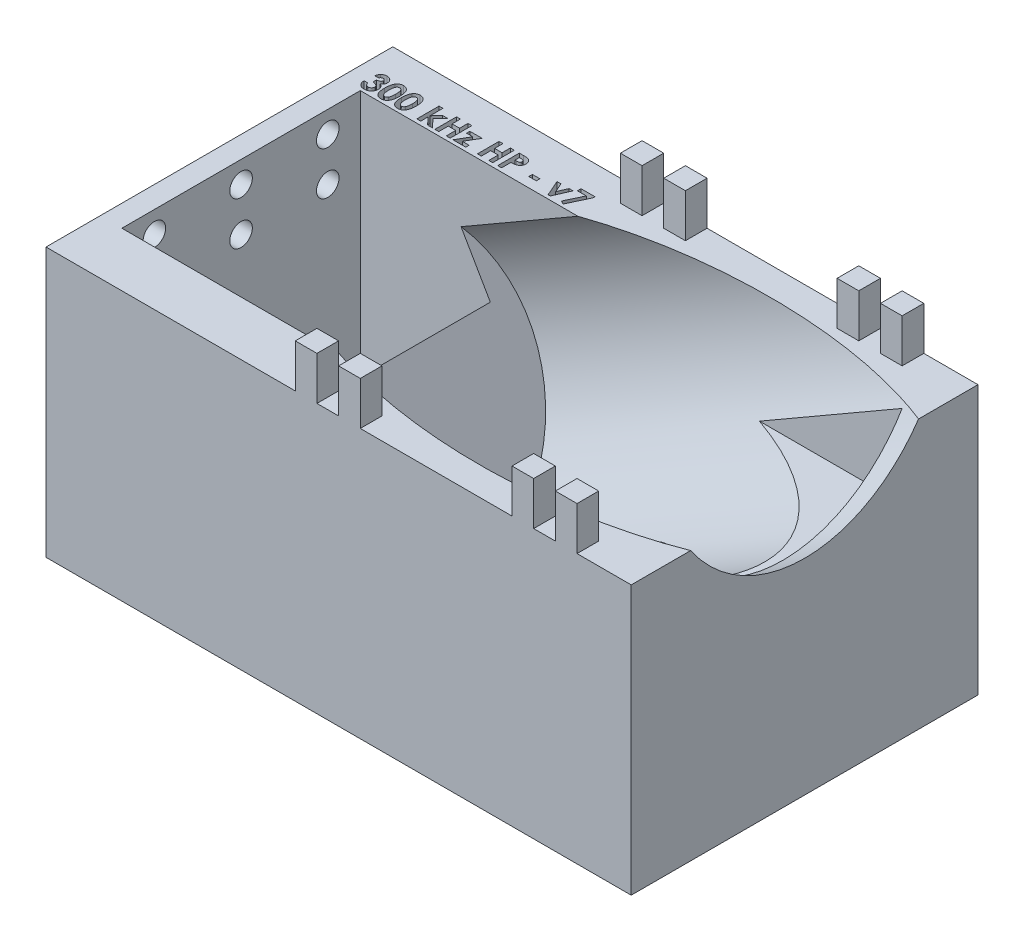
from build123d import *

# Parameters (mm, degrees)
SKETCH1_W                = 228.6
SKETCH1_H                = 127
BOSS_EXTRUDE1_DEPTH      = 50.8
SKETCH10_R               = 12.7
CUT_EXTRUDE6_DEPTH       = 196.514014843
SKETCH13_W               = 6.35
SKETCH13_H               = 6.35
BOSS_EXTRUDE3_DEPTH      = 12.7
SKETCH22_W               = 25.4
SKETCH22_H               = 101.6
CUT_EXTRUDE17_DEPTH      = 196.514014908
SKETCH23_W               = 254
SKETCH23_H               = 254
CUT_EXTRUDE18_DEPTH      = 48.26
SKETCH21_W               = 31.75
SKETCH21_H               = 101.6
CUT_EXTRUDE16_DEPTH      = 148.800939157
SKETCH26_W               = 88.9
SKETCH26_H               = 69.85
CUT_EXTRUDE21_DEPTH      = 25.4
CUT_EXTRUDE22_DEPTH      = 196.386105315
CUT_EXTRUDE22_DEPTH_BACK = 25.4
SKETCH27_R               = 3.302
SKETCH28_W               = 2.198076923
SKETCH28_H               = 1.058333333
CUT_EXTRUDE23_DEPTH      = 3.175
SKETCH30_R               = 3.429
CUT_EXTRUDE24_DEPTH      = 136.978989714
CUT_EXTRUDE25_DEPTH      = 136.978989714
CUT_EXTRUDE25_DEPTH_BACK = 46.99
SKETCH31_W               = 38.1
SKETCH31_H               = 69.85
CUT_EXTRUDE26_START      = -14.812699
SKETCH32_W               = 34.776392942
SKETCH32_H               = 69.85
CUT_EXTRUDE26_DEPTH      = 14.812699


with BuildPart() as part:
    # Sketch1 → Boss-Extrude1 (new, symmetric)
    with BuildSketch(Plane.XY):
        with Locations((-25.4, -63.5)):
            Rectangle(SKETCH1_W, SKETCH1_H)
    extrude(amount=BOSS_EXTRUDE1_DEPTH, both=True)

    # Sketch10 → Cut-Extrude6 (cut, through all)
    with BuildSketch(Plane.XZ.offset(127)):
        with Locations(Location((0, 0, 0), (0, 0, 270))):
            Circle(SKETCH10_R)
    extrude(amount=-CUT_EXTRUDE6_DEPTH, mode=Mode.SUBTRACT)

    # Sketch2 → Cut-Revolve1 (revolve, cut)
    with BuildSketch(Plane.XY, mode=Mode.PRIVATE) as cut_revolve1_sk:
        Polygon((0, 46.586734405), (-66.080481187, 8.435150804), (-87.55791114, -3.964849161), (-68.30288881, -37.315526138), (-66.28541114, -40.809899965), (0, -2.54), (87.988181024, 48.26), (66.715681024, 85.105050804), align=None)
    revolve(cut_revolve1_sk.sketch.rotate(Axis((-66.28541114, -40.809899965, 0), (0.8660254037844379, 0.5000000000000012, 0)), 180), axis=Axis((-66.28541114, -40.809899965, 0), (0.8660254037844379, 0.5000000000000012, 0)), mode=Mode.SUBTRACT)

    # Sketch13 → Boss-Extrude3 (add)
    with BuildSketch(Plane(origin=(0, 0, 0), x_dir=(1, 0, 0), z_dir=(0, 1, 0))):
        with Locations((-38.1, 47.625)):
            Rectangle(SKETCH13_W, SKETCH13_H)
        with Locations((-25.4, 47.625)):
            Rectangle(SKETCH13_W, SKETCH13_H)
        with Locations((25.4, 47.625)):
            Rectangle(SKETCH13_W, SKETCH13_H)
        with Locations((38.1, 47.625)):
            Rectangle(SKETCH13_W, SKETCH13_H)
        with Locations((38.1, -47.625)):
            Rectangle(SKETCH13_W, SKETCH13_H)
        with Locations((25.4, -47.625)):
            Rectangle(SKETCH13_W, SKETCH13_H)
        with Locations((-25.4, -47.625)):
            Rectangle(SKETCH13_W, SKETCH13_H)
        with Locations((-38.1, -47.625)):
            Rectangle(SKETCH13_W, SKETCH13_H)
    extrude(amount=BOSS_EXTRUDE3_DEPTH)

    # Sketch22 → Cut-Extrude17 (cut, through all)
    with BuildSketch(Plane(origin=(0, 0, 0), x_dir=(1, 0, 0), z_dir=(0, 1, 0))):
        with Locations((-127, 0)):
            Rectangle(SKETCH22_W, SKETCH22_H)
    extrude(amount=-CUT_EXTRUDE17_DEPTH, mode=Mode.SUBTRACT)

    # Sketch23 → Cut-Extrude18 (cut)
    with BuildSketch(Plane.XZ.offset(127)):
        Rectangle(SKETCH23_W, SKETCH23_H)
    extrude(amount=-CUT_EXTRUDE18_DEPTH, mode=Mode.SUBTRACT)

    # Sketch21 → Cut-Extrude16 (cut, through all)
    with BuildSketch(Plane(origin=(0, 0, 0), x_dir=(1, 0, 0), z_dir=(0, 1, 0))):
        with Locations((73.025, 0)):
            Rectangle(SKETCH21_W, SKETCH21_H)
    extrude(amount=-CUT_EXTRUDE16_DEPTH, mode=Mode.SUBTRACT)

    # Sketch26 → Cut-Extrude21 (cut)
    with BuildSketch(Plane(origin=(0, 0, 0), x_dir=(1, 0, 0), z_dir=(0, 1, 0))):
        with Locations((6.35, 0)):
            Rectangle(SKETCH26_W, SKETCH26_H)
    extrude(amount=-CUT_EXTRUDE21_DEPTH, mode=Mode.SUBTRACT)

    # Sketch27 → Cut-Extrude22 (cut, two sides: drawn at the far end of the back side and taken through both)
    with BuildSketch(Plane.ZY.offset(114.3).offset(-CUT_EXTRUDE22_DEPTH_BACK)):
        with Locations(Location((-25.4, -6.35, 0), (0, 0, 180))):
            Circle(SKETCH27_R)
        with Locations(Location((0, -6.35, 0), (0, 0, 180))):
            Circle(SKETCH27_R)
        with Locations(Location((0, -19.05, 0), (0, 0, 180))):
            Circle(SKETCH27_R)
        with Locations(Location((25.4, -6.35, 0), (0, 0, 180))):
            Circle(SKETCH27_R)
        with Locations(Location((25.4, -19.05, 0), (0, 0, 180))):
            Circle(SKETCH27_R)
        with Locations(Location((-25.4, -19.05, 0), (0, 0, 180))):
            Circle(SKETCH27_R)
    extrude(amount=CUT_EXTRUDE22_DEPTH + CUT_EXTRUDE22_DEPTH_BACK, mode=Mode.SUBTRACT)

    # Sketch28 → Cut-Extrude23 (cut)
    # profile 1 of 11: a face of its own
    with BuildSketch(Plane(origin=(0, 0, 0), x_dir=(1, 0, 0), z_dir=(0, 1, 0))):
        with BuildLine():
            Line((-108.439595668, 40.823041991), (-109.579339258, 40.823041991))
            add(Edge.make_bspline(
                [(-109.579339258, 40.823041991), (-109.571292235, 40.880013707), (-109.555516579, 40.991702982), (-109.517767544, 41.15340123), (-109.472615625, 41.306783084), (-109.41624576, 41.451362816), (-109.35013308, 41.587397969), (-109.274949876, 41.71535535), (-109.18988339, 41.834685743), (-109.124679027, 41.906570845), (-109.092149755, 41.942433016)],
                knots=[0, 0, 0, 0, 1.111473889, 2.178970933, 3.205615836, 4.199322666, 5.174200091, 6.12565194, 7.064921805, 8, 8, 8, 8], degree=3))
            add(Edge.make_bspline(
                [(-109.092149755, 41.942433016), (-109.04523059, 41.989750553), (-108.952757848, 42.083008445), (-108.798225049, 42.202461503), (-108.636246138, 42.305840002), (-108.463572556, 42.387799223), (-108.282891233, 42.454135718), (-108.092765331, 42.498694091), (-107.893971771, 42.528258965), (-107.758320175, 42.531171208), (-107.689094867, 42.532657375)],
                knots=[0, 0, 0, 0, 1.01925491, 2.00884431, 2.983262333, 3.955970413, 4.92937149, 5.924503185, 6.940838805, 8, 8, 8, 8], degree=3))
            add(Edge.make_bspline(
                [(-107.689094867, 42.532657375), (-107.627550006, 42.531204422), (-107.506565211, 42.528348208), (-107.328748005, 42.505420072), (-107.15921418, 42.465206676), (-106.996171714, 42.412628563), (-106.84201843, 42.341087252), (-106.693352017, 42.258043018), (-106.554326218, 42.156185813), (-106.42461574, 42.041097423), (-106.305451927, 41.916618062), (-106.202255542, 41.783559862), (-106.113535759, 41.645477115), (-106.040442393, 41.501222613), (-105.984243527, 41.350552262), (-105.945239847, 41.194336462), (-105.919710992, 41.032919917), (-105.917167651, 40.923207266), (-105.915877719, 40.867563225)],
                knots=[0, 0, 0, 0, 1.091422571, 2.145516843, 3.172569842, 4.178562979, 5.178154469, 6.181868002, 7.194278174, 8.227918432, 9.254613415, 10.245994977, 11.209837596, 12.161663635, 13.10878368, 14.055455738, 15.013766427, 16, 16, 16, 16], degree=3))
            add(Edge.make_bspline(
                [(-105.915877719, 40.867563225), (-105.918524735, 40.798652714), (-105.923735896, 40.662989104), (-105.966497241, 40.464435331), (-106.033430374, 40.274582491), (-106.130121795, 40.09608691), (-106.251010699, 39.929434354), (-106.399337334, 39.780196517), (-106.570876975, 39.646033552), (-106.699654067, 39.573934358), (-106.765597271, 39.537014347)],
                knots=[0, 0, 0, 0, 0.992805628, 1.954529043, 2.915727527, 3.886831945, 4.871318353, 5.87440735, 6.911542536, 8, 8, 8, 8], degree=3))
            add(Edge.make_bspline(
                [(-106.765597271, 39.537014347), (-106.720334868, 39.522153747), (-106.631396276, 39.492953334), (-106.504980761, 39.435443453), (-106.384774052, 39.372594684), (-106.272846064, 39.299580983), (-106.16808354, 39.2193547), (-106.071125122, 39.13123003), (-105.981391508, 39.035399128), (-105.900347562, 38.931334959), (-105.828417893, 38.820701827), (-105.763879232, 38.706055293), (-105.710760316, 38.58565672), (-105.665761981, 38.460881142), (-105.631502811, 38.330607142), (-105.607381294, 38.195339519), (-105.593438465, 38.05538683), (-105.591311945, 37.960568968), (-105.590236694, 37.912625324)],
                knots=[0, 0, 0, 0, 1.059543567, 2.081955587, 3.086750234, 4.076226789, 5.052108497, 6.020845489, 6.989030705, 7.970690546, 8.952259656, 9.923888338, 10.895517021, 11.877585046, 12.873342345, 13.889638361, 14.932918083, 16, 16, 16, 16], degree=3))
            add(Edge.make_bspline(
                [(-105.590236694, 37.912625324), (-105.592416374, 37.842167634), (-105.596714258, 37.703239418), (-105.624038199, 37.498612373), (-105.674910453, 37.303518667), (-105.741835722, 37.11571345), (-105.831106766, 36.937621221), (-105.936163778, 36.765155005), (-106.065299953, 36.604295884), (-106.208812638, 36.450791159), (-106.368191842, 36.311231537), (-106.540984827, 36.190239624), (-106.723392024, 36.086407035), (-106.916567472, 36.002112782), (-107.120444057, 35.937196566), (-107.334567356, 35.890272133), (-107.559837056, 35.861562988), (-107.713601251, 35.858553379), (-107.792129723, 35.85701635)],
                knots=[0, 0, 0, 0, 1.005138573, 1.981928558, 2.936866704, 3.876260664, 4.820238198, 5.773547, 6.751179199, 7.756627054, 8.768222608, 9.766606018, 10.760583154, 11.757261445, 12.767156078, 13.807575856, 14.880313354, 16, 16, 16, 16], degree=3))
            add(Edge.make_bspline(
                [(-107.792129723, 35.85701635), (-107.86641639, 35.858636887), (-108.011674137, 35.861805633), (-108.224143994, 35.889232737), (-108.426076481, 35.933474881), (-108.617986934, 35.995837851), (-108.799132866, 36.076711966), (-108.971156979, 36.173014891), (-109.13062657, 36.290301154), (-109.279318443, 36.423276232), (-109.413934166, 36.57246672), (-109.53424892, 36.734416693), (-109.637609746, 36.909741981), (-109.724440526, 37.097693522), (-109.79406244, 37.298601039), (-109.848980002, 37.512055976), (-109.887340818, 37.738475358), (-109.899023685, 37.894256709), (-109.904980283, 37.973683016)],
                knots=[0, 0, 0, 0, 1.066544725, 2.085487077, 3.070979577, 4.031932826, 4.977951092, 5.916076795, 6.857635327, 7.814973522, 8.776389752, 9.738577119, 10.707772778, 11.69409279, 12.707140348, 13.757286496, 14.856535458, 16, 16, 16, 16], degree=3))
            Line((-109.904980283, 37.973683016), (-108.765236694, 37.973683016))
            add(Edge.make_bspline(
                [(-108.765236694, 37.973683016), (-108.758014257, 37.933746426), (-108.743946669, 37.855959444), (-108.7165087, 37.743341187), (-108.680753198, 37.639387579), (-108.639410942, 37.543174684), (-108.594755082, 37.453439261), (-108.540800124, 37.373495461), (-108.481499604, 37.301172481), (-108.395928521, 37.215194125), (-108.273598765, 37.126854954), (-108.108413067, 37.050084011), (-107.92465962, 37.005086807), (-107.796197635, 36.999597286), (-107.729799995, 36.996759939)],
                knots=[0, 0, 0, 0, 0.928156231, 1.807827665, 2.648129825, 3.438902246, 4.202261636, 4.936546065, 5.639352463, 6.338805438, 7.70633318, 9.064371875, 10.482673459, 12, 12, 12, 12], degree=3))
            add(Edge.make_bspline(
                [(-107.729799995, 36.996759939), (-107.69456706, 36.997364126), (-107.625553623, 36.998547592), (-107.524183161, 37.011664725), (-107.427613522, 37.033268655), (-107.335664841, 37.062627594), (-107.247751768, 37.09943086), (-107.165553968, 37.146886469), (-107.087396046, 37.202060389), (-107.01412765, 37.264090522), (-106.946426141, 37.331681163), (-106.890094505, 37.406526313), (-106.838611465, 37.482582364), (-106.800534238, 37.564825169), (-106.767170384, 37.648829187), (-106.746750001, 37.7376435), (-106.731331146, 37.829405024), (-106.730435064, 37.892202582), (-106.729980283, 37.924073641)],
                knots=[0, 0, 0, 0, 1.110435564, 2.175094844, 3.216326037, 4.226890168, 5.215276772, 6.21526065, 7.213097102, 8.228249917, 9.239874822, 10.221364777, 11.178138315, 12.128914389, 13.072518965, 14.022636769, 14.996447288, 16, 16, 16, 16], degree=3))
            add(Edge.make_bspline(
                [(-106.729980283, 37.924073641), (-106.73118764, 37.958930074), (-106.733591209, 38.028321246), (-106.753228623, 38.129583069), (-106.784240251, 38.226988782), (-106.827319189, 38.320107026), (-106.88484631, 38.408594586), (-106.952727671, 38.49422679), (-107.036311201, 38.572546634), (-107.128013528, 38.649963427), (-107.234352201, 38.717447522), (-107.350148378, 38.779725426), (-107.478445363, 38.829279411), (-107.616111312, 38.873540297), (-107.765750304, 38.905867762), (-107.926433137, 38.929340651), (-108.097900607, 38.94681258), (-108.216095362, 38.949319216), (-108.276775155, 38.950606093)],
                knots=[0, 0, 0, 0, 0.809814727, 1.612155564, 2.388397, 3.182215007, 3.988903953, 4.837162975, 5.715530372, 6.646997145, 7.623086902, 8.637258368, 9.698941581, 10.815059213, 11.996518529, 13.252603015, 14.589518788, 16, 16, 16, 16], degree=3))
            Line((-108.276775155, 38.950606093), (-108.276775155, 40.008939427))
            add(Edge.make_bspline(
                [(-108.276775155, 40.008939427), (-108.201225204, 40.015373502), (-108.059886206, 40.027410384), (-107.863700099, 40.055559049), (-107.698536686, 40.093184375), (-107.560426262, 40.138577293), (-107.445748216, 40.196873627), (-107.345566107, 40.261230206), (-107.259284537, 40.335970966), (-107.186365035, 40.418867149), (-107.128031703, 40.507889877), (-107.086746769, 40.601655471), (-107.059484355, 40.69726271), (-107.056901244, 40.762655179), (-107.055621309, 40.795057215)],
                knots=[0, 0, 0, 0, 1.70044513, 3.18119609, 4.440695891, 5.496282586, 6.431922213, 7.318171381, 8.16090191, 8.983045123, 9.787564368, 10.536848927, 11.275007137, 12, 12, 12, 12], degree=3))
            add(Edge.make_bspline(
                [(-107.055621309, 40.795057215), (-107.057829562, 40.836398695), (-107.062139605, 40.917088511), (-107.095613734, 41.032572635), (-107.153721029, 41.135517161), (-107.231632708, 41.225705463), (-107.326570798, 41.301037492), (-107.437854882, 41.355727261), (-107.56307009, 41.387859942), (-107.651165735, 41.391191018), (-107.696727078, 41.392913786)],
                knots=[0, 0, 0, 0, 1.009664648, 1.970651636, 2.907870547, 3.878035693, 4.867062054, 5.849714035, 6.887914197, 8, 8, 8, 8], degree=3))
            add(Edge.make_bspline(
                [(-107.696727078, 41.392913786), (-107.738023313, 41.390881101), (-107.819967691, 41.386847633), (-107.939794899, 41.356742892), (-108.053590825, 41.306065308), (-108.158999075, 41.236183907), (-108.254498061, 41.152259306), (-108.332875175, 41.052868036), (-108.398065543, 40.9439648), (-108.425698023, 40.863507611), (-108.439595668, 40.823041991)],
                knots=[0, 0, 0, 0, 0.98818071, 1.960853194, 2.938124878, 3.957524365, 4.978590984, 5.968022688, 6.978025184, 8, 8, 8, 8], degree=3))
        make_face()
    # profile 2 of 11: a face of its own
    with BuildSketch(Plane(origin=(0, 0, 0), x_dir=(1, 0, 0), z_dir=(0, 1, 0))):
        with BuildLine():
            add(Edge.make_bspline(
                [(-102.882073633, 42.532657375), (-102.826905313, 42.531838386), (-102.718429655, 42.530228034), (-102.55866543, 42.512786614), (-102.40476831, 42.486437491), (-102.25613623, 42.449689654), (-102.113839057, 42.401055199), (-101.976841125, 42.342840591), (-101.846773105, 42.271992353), (-101.721976214, 42.19196563), (-101.602498525, 42.101364034), (-101.491211599, 41.998073537), (-101.386083101, 41.884470857), (-101.289388676, 41.758838526), (-101.198986996, 41.622319302), (-101.115175106, 41.474891538), (-101.038594608, 41.315833674), (-100.968387215, 41.144858678), (-100.905607543, 40.959403708), (-100.852728303, 40.757341515), (-100.807375507, 40.538625954), (-100.769094546, 40.302712611), (-100.740160327, 40.049287898), (-100.720658081, 39.77852018), (-100.707274717, 39.490931456), (-100.70618246, 39.293647954), (-100.705621309, 39.192292792)],
                knots=[0, 0, 0, 0, 0.879237366, 1.728815576, 2.559023295, 3.367336655, 4.166867292, 4.954216142, 5.737608147, 6.525189134, 7.316157332, 8.124696809, 8.942788509, 9.781158001, 10.649253743, 11.551476218, 12.482711956, 13.461909668, 14.496590415, 15.601789533, 16.789733467, 18.056700938, 19.410929216, 20.8549011, 22.384193279, 24, 24, 24, 24], degree=3))
            add(Edge.make_bspline(
                [(-100.705621309, 39.192292792), (-100.706227762, 39.089669563), (-100.707406089, 38.89027447), (-100.720101731, 38.600055314), (-100.741964227, 38.327321659), (-100.770142189, 38.072101723), (-100.80873829, 37.834530282), (-100.853939689, 37.613992186), (-100.907653612, 37.410567376), (-100.972501226, 37.22471421), (-101.042283652, 37.053438944), (-101.119073631, 36.894691206), (-101.201532725, 36.748041017), (-101.287769572, 36.611275962), (-101.382511992, 36.488427804), (-101.481148604, 36.375319063), (-101.587974223, 36.276258196), (-101.698491078, 36.186140052), (-101.816747847, 36.10825989), (-101.94152498, 36.040147184), (-102.075047036, 35.984899691), (-102.214880136, 35.936848371), (-102.363407762, 35.902352709), (-102.518269832, 35.874981534), (-102.681214706, 35.859854544), (-102.79215414, 35.857977941), (-102.849000716, 35.85701635)],
                knots=[0, 0, 0, 0, 1.643780988, 3.193836972, 4.651895693, 6.025988579, 7.305620092, 8.505800249, 9.631074763, 10.672816429, 11.65661981, 12.592235626, 13.49536222, 14.350718032, 15.179365177, 15.97804903, 16.751647189, 17.51006938, 18.259804725, 19.016521909, 19.783502495, 20.571750527, 21.382245291, 22.22305063, 23.089471752, 24, 24, 24, 24], degree=3))
            add(Edge.make_bspline(
                [(-102.849000716, 35.85701635), (-102.905845758, 35.85799649), (-103.01720436, 35.85991657), (-103.180589853, 35.874869058), (-103.336272614, 35.90246359), (-103.485975333, 35.937113203), (-103.628656102, 35.984793372), (-103.764999071, 36.041693832), (-103.893955882, 36.109381548), (-104.015883594, 36.187443163), (-104.130365913, 36.276958349), (-104.239181892, 36.37696964), (-104.342090825, 36.487223534), (-104.437527211, 36.608954965), (-104.527054023, 36.740539073), (-104.609737636, 36.883478484), (-104.685528362, 37.037565081), (-104.756796946, 37.203013646), (-104.818720325, 37.383386097), (-104.873829257, 37.580293136), (-104.918973045, 37.795376147), (-104.955280699, 38.028566031), (-104.98426871, 38.279368765), (-105.005832458, 38.547905405), (-105.018598619, 38.834301029), (-105.019764588, 39.031155007), (-105.020364899, 39.132507135)],
                knots=[0, 0, 0, 0, 0.917216111, 1.796812873, 2.643793957, 3.46689424, 4.273913431, 5.068098542, 5.848489301, 6.620921603, 7.401012384, 8.190319798, 9.003608147, 9.831726257, 10.68377682, 11.569763213, 12.493818149, 13.453288342, 14.474581811, 15.568529029, 16.750744269, 18.018426408, 19.375425659, 20.823733699, 22.36466933, 24, 24, 24, 24], degree=3))
            add(Edge.make_bspline(
                [(-105.020364899, 39.132507135), (-105.019277492, 39.273327938), (-105.017179328, 39.545043491), (-104.990589845, 39.937593463), (-104.951563229, 40.300437914), (-104.894242373, 40.632969892), (-104.823365929, 40.936421), (-104.732604951, 41.208792261), (-104.62928018, 41.453852541), (-104.5412342, 41.599027727), (-104.498830444, 41.668945436)],
                knots=[0, 0, 0, 0, 1.288568992, 2.486310467, 3.599230591, 4.627010532, 5.572937695, 6.447898582, 7.252493626, 8, 8, 8, 8], degree=3))
            add(Edge.make_bspline(
                [(-104.498830444, 41.668945436), (-104.449525375, 41.737632572), (-104.353124251, 41.871929459), (-104.184564191, 42.048236167), (-104.003468352, 42.199022297), (-103.80611713, 42.320875424), (-103.595631717, 42.416968809), (-103.370204987, 42.484838486), (-103.130669404, 42.524382521), (-102.966176324, 42.529857901), (-102.882073633, 42.532657375)],
                knots=[0, 0, 0, 0, 1.058512271, 2.069600068, 3.047294572, 4.004278952, 4.967380941, 5.939006123, 6.946246673, 8, 8, 8, 8], degree=3))
        make_face()
        with BuildLine():
            add(Edge.make_bspline(
                [(-102.854088857, 41.392913786), (-102.903961476, 41.390549923), (-103.001738283, 41.385915496), (-103.143617089, 41.346575756), (-103.277399945, 41.285813406), (-103.37916499, 41.212695417), (-103.455335114, 41.142603057), (-103.508555726, 41.07917175), (-103.559878618, 41.008386984), (-103.60520958, 40.927054605), (-103.648013842, 40.838096982), (-103.689846508, 40.7411103), (-103.72413831, 40.633712357), (-103.757829096, 40.517732154), (-103.787345368, 40.389963146), (-103.812073533, 40.249360963), (-103.834165975, 40.095011255), (-103.849575717, 39.926812923), (-103.86394222, 39.744941945), (-103.874240811, 39.548993182), (-103.878546393, 39.339019497), (-103.879915006, 39.194413736), (-103.880621309, 39.119786782)],
                knots=[0, 0, 0, 0, 1.076674018, 2.110852608, 3.161083442, 4.239746716, 4.804137807, 5.395870207, 6.026861976, 6.692161227, 7.405688833, 8.16177676, 8.973626916, 9.841385931, 10.773283133, 11.807421078, 12.927755683, 14.143907515, 15.458935494, 16.872852025, 18.386167141, 20, 20, 20, 20], degree=3))
            add(Edge.make_bspline(
                [(-103.880621309, 39.119786782), (-103.87945882, 39.023103956), (-103.877229662, 38.837707467), (-103.865554372, 38.571100861), (-103.842152222, 38.328467382), (-103.813044673, 38.108162613), (-103.772161932, 37.911615289), (-103.725123692, 37.73696589), (-103.667035647, 37.586440772), (-103.59990372, 37.457863004), (-103.525552085, 37.348482163), (-103.444840115, 37.255507956), (-103.360515762, 37.174996679), (-103.26994699, 37.109598361), (-103.173349869, 37.059480104), (-103.071530807, 37.023430661), (-102.964425099, 37.001363296), (-102.891080214, 36.998303262), (-102.854088857, 36.996759939)],
                knots=[0, 0, 0, 0, 1.771748488, 3.397459088, 4.888034009, 6.237357457, 7.467047327, 8.564189669, 9.548206622, 10.417051504, 11.216568818, 11.965764335, 12.669334354, 13.348544111, 14.005342236, 14.656555988, 15.322436492, 16, 16, 16, 16], degree=3))
            add(Edge.make_bspline(
                [(-102.854088857, 36.996759939), (-102.818366926, 36.997815995), (-102.748427827, 36.999883622), (-102.646440957, 37.021107527), (-102.549994925, 37.055612988), (-102.459380933, 37.104423385), (-102.374274868, 37.166493273), (-102.295092674, 37.242095413), (-102.222431528, 37.331983383), (-102.180098815, 37.398693551), (-102.158285572, 37.433068032)],
                knots=[0, 0, 0, 0, 0.992283464, 1.942767638, 2.88273346, 3.832339453, 4.79467288, 5.803907806, 6.868395428, 8, 8, 8, 8], degree=3))
            add(Edge.make_bspline(
                [(-102.158285572, 37.433068032), (-102.132604152, 37.480039663), (-102.078752298, 37.578535363), (-102.01643484, 37.744743184), (-101.963979477, 37.932198135), (-101.918831912, 38.141483595), (-101.887953733, 38.373425011), (-101.861361482, 38.626551622), (-101.848535379, 38.902138072), (-101.846449143, 39.093065359), (-101.845364899, 39.192292792)],
                knots=[0, 0, 0, 0, 0.710965849, 1.490837728, 2.352621235, 3.297892224, 4.334225155, 5.461620853, 6.680770821, 8, 8, 8, 8], degree=3))
            add(Edge.make_bspline(
                [(-101.845364899, 39.192292792), (-101.845783719, 39.292381567), (-101.846589876, 39.485035374), (-101.861380526, 39.761612576), (-101.881977637, 40.014219949), (-101.912105264, 40.242293522), (-101.950869932, 40.446386958), (-101.998647532, 40.626486915), (-102.054973767, 40.782948336), (-102.12176997, 40.915615207), (-102.195750915, 41.028363849), (-102.274283947, 41.125093438), (-102.357701135, 41.20767872), (-102.445862978, 41.27643048), (-102.540810013, 41.32896198), (-102.640728629, 41.366053565), (-102.745823665, 41.38849273), (-102.817513358, 41.391420209), (-102.854088857, 41.392913786)],
                knots=[0, 0, 0, 0, 1.793836731, 3.452829483, 4.963243077, 6.335886805, 7.574563692, 8.684454726, 9.672768357, 10.54971625, 11.340229787, 12.085688095, 12.778991901, 13.440269426, 14.083255152, 14.715733572, 15.344777694, 16, 16, 16, 16], degree=3))
        make_face(mode=Mode.SUBTRACT)
    # profile 3 of 11: a face of its own
    with BuildSketch(Plane(origin=(0, 0, 0), x_dir=(1, 0, 0), z_dir=(0, 1, 0))):
        with BuildLine():
            add(Edge.make_bspline(
                [(-97.997458248, 42.532657375), (-97.942289928, 42.531838386), (-97.83381427, 42.530228034), (-97.674050046, 42.512786614), (-97.520152926, 42.486437491), (-97.371520845, 42.449689654), (-97.229223673, 42.401055199), (-97.092225741, 42.342840591), (-96.962157721, 42.271992353), (-96.83736083, 42.19196563), (-96.71788314, 42.101364034), (-96.606596214, 41.998073537), (-96.501467716, 41.884470857), (-96.404773291, 41.758838526), (-96.314371611, 41.622319302), (-96.230559722, 41.474891538), (-96.153979223, 41.315833674), (-96.083771831, 41.144858678), (-96.020992158, 40.959403708), (-95.968112919, 40.757341515), (-95.922760122, 40.538625954), (-95.884479162, 40.302712611), (-95.855544943, 40.049287898), (-95.836042697, 39.77852018), (-95.822659333, 39.490931456), (-95.821567076, 39.293647954), (-95.821005924, 39.192292792)],
                knots=[0, 0, 0, 0, 0.879237366, 1.728815576, 2.559023295, 3.367336655, 4.166867292, 4.954216142, 5.737608147, 6.525189134, 7.316157332, 8.124696809, 8.942788509, 9.781158001, 10.649253743, 11.551476218, 12.482711956, 13.461909668, 14.496590415, 15.601789533, 16.789733467, 18.056700938, 19.410929216, 20.8549011, 22.384193279, 24, 24, 24, 24], degree=3))
            add(Edge.make_bspline(
                [(-95.821005924, 39.192292792), (-95.821612377, 39.089669563), (-95.822790704, 38.89027447), (-95.835486347, 38.600055314), (-95.857348842, 38.327321659), (-95.885526805, 38.072101723), (-95.924122905, 37.834530282), (-95.969324304, 37.613992186), (-96.023038227, 37.410567376), (-96.087885842, 37.22471421), (-96.157668267, 37.053438944), (-96.234458246, 36.894691206), (-96.316917341, 36.748041017), (-96.403154187, 36.611275962), (-96.497896607, 36.488427804), (-96.59653322, 36.375319063), (-96.703358839, 36.276258196), (-96.813875693, 36.186140052), (-96.932132462, 36.10825989), (-97.056909595, 36.040147184), (-97.190431651, 35.984899691), (-97.330264751, 35.936848371), (-97.478792377, 35.902352709), (-97.633654447, 35.874981534), (-97.796599321, 35.859854544), (-97.907538755, 35.857977941), (-97.964385332, 35.85701635)],
                knots=[0, 0, 0, 0, 1.643780988, 3.193836972, 4.651895693, 6.025988579, 7.305620092, 8.505800249, 9.631074763, 10.672816429, 11.65661981, 12.592235626, 13.49536222, 14.350718032, 15.179365177, 15.97804903, 16.751647189, 17.51006938, 18.259804725, 19.016521909, 19.783502495, 20.571750527, 21.382245291, 22.22305063, 23.089471752, 24, 24, 24, 24], degree=3))
            add(Edge.make_bspline(
                [(-97.964385332, 35.85701635), (-98.021230374, 35.85799649), (-98.132588975, 35.85991657), (-98.295974469, 35.874869058), (-98.451657229, 35.90246359), (-98.601359948, 35.937113203), (-98.744040717, 35.984793372), (-98.880383687, 36.041693832), (-99.009340497, 36.109381548), (-99.131268209, 36.187443163), (-99.245750528, 36.276958349), (-99.354566507, 36.37696964), (-99.45747544, 36.487223534), (-99.552911827, 36.608954965), (-99.642438638, 36.740539073), (-99.725122252, 36.883478484), (-99.800912977, 37.037565081), (-99.872181562, 37.203013646), (-99.93410494, 37.383386097), (-99.989213872, 37.580293136), (-100.03435766, 37.795376147), (-100.070665315, 38.028566031), (-100.099653325, 38.279368765), (-100.121217073, 38.547905405), (-100.133983234, 38.834301029), (-100.135149204, 39.031155007), (-100.135749514, 39.132507135)],
                knots=[0, 0, 0, 0, 0.917216111, 1.796812873, 2.643793957, 3.46689424, 4.273913431, 5.068098542, 5.848489301, 6.620921603, 7.401012384, 8.190319798, 9.003608147, 9.831726257, 10.68377682, 11.569763213, 12.493818149, 13.453288342, 14.474581811, 15.568529029, 16.750744269, 18.018426408, 19.375425659, 20.823733699, 22.36466933, 24, 24, 24, 24], degree=3))
            add(Edge.make_bspline(
                [(-100.135749514, 39.132507135), (-100.134662108, 39.273327938), (-100.132563943, 39.545043491), (-100.105974461, 39.937593463), (-100.066947844, 40.300437914), (-100.009626989, 40.632969892), (-99.938750544, 40.936421), (-99.847989566, 41.208792261), (-99.744664795, 41.453852541), (-99.656618816, 41.599027727), (-99.614215059, 41.668945436)],
                knots=[0, 0, 0, 0, 1.288568992, 2.486310467, 3.599230591, 4.627010532, 5.572937695, 6.447898582, 7.252493626, 8, 8, 8, 8], degree=3))
            add(Edge.make_bspline(
                [(-99.614215059, 41.668945436), (-99.564909991, 41.737632572), (-99.468508867, 41.871929459), (-99.299948806, 42.048236167), (-99.118852968, 42.199022297), (-98.921501746, 42.320875424), (-98.711016332, 42.416968809), (-98.485589602, 42.484838486), (-98.246054019, 42.524382521), (-98.081560939, 42.529857901), (-97.997458248, 42.532657375)],
                knots=[0, 0, 0, 0, 1.058512271, 2.069600068, 3.047294572, 4.004278952, 4.967380941, 5.939006123, 6.946246673, 8, 8, 8, 8], degree=3))
        make_face()
        with BuildLine():
            add(Edge.make_bspline(
                [(-97.969473473, 41.392913786), (-98.019346092, 41.390549923), (-98.117122899, 41.385915496), (-98.259001705, 41.346575756), (-98.39278456, 41.285813406), (-98.494549605, 41.212695417), (-98.570719729, 41.142603057), (-98.623940341, 41.07917175), (-98.675263233, 41.008386984), (-98.720594196, 40.927054605), (-98.763398458, 40.838096982), (-98.805231124, 40.7411103), (-98.839522925, 40.633712357), (-98.873213711, 40.517732154), (-98.902729983, 40.389963146), (-98.927458148, 40.249360963), (-98.94955059, 40.095011255), (-98.964960332, 39.926812923), (-98.979326836, 39.744941945), (-98.989625426, 39.548993182), (-98.993931008, 39.339019497), (-98.995299622, 39.194413736), (-98.996005924, 39.119786782)],
                knots=[0, 0, 0, 0, 1.076674018, 2.110852608, 3.161083442, 4.239746716, 4.804137807, 5.395870207, 6.026861976, 6.692161227, 7.405688833, 8.16177676, 8.973626916, 9.841385931, 10.773283133, 11.807421078, 12.927755683, 14.143907515, 15.458935494, 16.872852025, 18.386167141, 20, 20, 20, 20], degree=3))
            add(Edge.make_bspline(
                [(-98.996005924, 39.119786782), (-98.994843436, 39.023103956), (-98.992614277, 38.837707467), (-98.980938987, 38.571100861), (-98.957536838, 38.328467382), (-98.928429289, 38.108162613), (-98.887546547, 37.911615289), (-98.840508307, 37.73696589), (-98.782420263, 37.586440772), (-98.715288335, 37.457863004), (-98.6409367, 37.348482163), (-98.56022473, 37.255507956), (-98.475900378, 37.174996679), (-98.385331606, 37.109598361), (-98.288734485, 37.059480104), (-98.186915422, 37.023430661), (-98.079809714, 37.001363296), (-98.00646483, 36.998303262), (-97.969473473, 36.996759939)],
                knots=[0, 0, 0, 0, 1.771748488, 3.397459088, 4.888034009, 6.237357457, 7.467047327, 8.564189669, 9.548206622, 10.417051504, 11.216568818, 11.965764335, 12.669334354, 13.348544111, 14.005342236, 14.656555988, 15.322436492, 16, 16, 16, 16], degree=3))
            add(Edge.make_bspline(
                [(-97.969473473, 36.996759939), (-97.933751541, 36.997815995), (-97.863812442, 36.999883622), (-97.761825572, 37.021107527), (-97.665379541, 37.055612988), (-97.574765549, 37.104423385), (-97.489659483, 37.166493273), (-97.410477289, 37.242095413), (-97.337816143, 37.331983383), (-97.29548343, 37.398693551), (-97.273670187, 37.433068032)],
                knots=[0, 0, 0, 0, 0.992283464, 1.942767638, 2.88273346, 3.832339453, 4.79467288, 5.803907806, 6.868395428, 8, 8, 8, 8], degree=3))
            add(Edge.make_bspline(
                [(-97.273670187, 37.433068032), (-97.247988768, 37.480039663), (-97.194136914, 37.578535363), (-97.131819455, 37.744743184), (-97.079364092, 37.932198135), (-97.034216528, 38.141483595), (-97.003338348, 38.373425011), (-96.976746097, 38.626551622), (-96.963919994, 38.902138072), (-96.961833758, 39.093065359), (-96.960749514, 39.192292792)],
                knots=[0, 0, 0, 0, 0.710965849, 1.490837728, 2.352621235, 3.297892224, 4.334225155, 5.461620853, 6.680770821, 8, 8, 8, 8], degree=3))
            add(Edge.make_bspline(
                [(-96.960749514, 39.192292792), (-96.961168334, 39.292381567), (-96.961974492, 39.485035374), (-96.976765142, 39.761612576), (-96.997362252, 40.014219949), (-97.027489879, 40.242293522), (-97.066254547, 40.446386958), (-97.114032147, 40.626486915), (-97.170358383, 40.782948336), (-97.237154586, 40.915615207), (-97.311135531, 41.028363849), (-97.389668562, 41.125093438), (-97.47308575, 41.20767872), (-97.561247593, 41.27643048), (-97.656194629, 41.32896198), (-97.756113244, 41.366053565), (-97.86120828, 41.38849273), (-97.932897973, 41.391420209), (-97.969473473, 41.392913786)],
                knots=[0, 0, 0, 0, 1.793836731, 3.452829483, 4.963243077, 6.335886805, 7.574563692, 8.684454726, 9.672768357, 10.54971625, 11.340229787, 12.085688095, 12.778991901, 13.440269426, 14.083255152, 14.715733572, 15.344777694, 16, 16, 16, 16], degree=3))
        make_face(mode=Mode.SUBTRACT)
    # profile 4 of 11: a face of its own
    with BuildSketch(Plane(origin=(0, 0, 0), x_dir=(1, 0, 0), z_dir=(0, 1, 0))):
        Polygon((-92.483185412, 42.532657375), (-91.343441822, 42.532657375), (-91.343441822, 38.7343601), (-89.570224674, 40.660221478), (-88.162081646, 40.660221478), (-90.198610091, 38.448152167), (-87.870785572, 36.019836863), (-89.305641341, 36.019836863), (-91.343441822, 38.145407776), (-91.343441822, 36.019836863), (-92.483185412, 36.019836863), align=None)
    # profile 5 of 11: a face of its own
    with BuildSketch(Plane(origin=(0, 0, 0), x_dir=(1, 0, 0), z_dir=(0, 1, 0))):
        Polygon((-87.191518745, 42.369836863), (-86.051775155, 42.369836863), (-86.051775155, 39.92752917), (-83.853698232, 39.92752917), (-83.853698232, 42.369836863), (-82.713954642, 42.369836863), (-82.713954642, 36.019836863), (-83.853698232, 36.019836863), (-83.853698232, 38.78778558), (-86.051775155, 38.78778558), (-86.051775155, 36.019836863), (-87.191518745, 36.019836863), align=None)
    # profile 6 of 11: a face of its own
    with BuildSketch(Plane(origin=(0, 0, 0), x_dir=(1, 0, 0), z_dir=(0, 1, 0))):
        Polygon((-81.574211053, 40.660221478), (-77.992159771, 40.660221478), (-80.126634931, 36.996759939), (-78.154980283, 36.996759939), (-78.154980283, 36.019836863), (-81.899852078, 36.019836863), (-79.765376918, 39.683298401), (-81.574211053, 39.683298401), align=None)
    # profile 7 of 11: a face of its own
    with BuildSketch(Plane(origin=(0, 0, 0), x_dir=(1, 0, 0), z_dir=(0, 1, 0))):
        Polygon((-74.735749514, 42.369836863), (-73.596005924, 42.369836863), (-73.596005924, 39.92752917), (-71.397929001, 39.92752917), (-71.397929001, 42.369836863), (-70.258185412, 42.369836863), (-70.258185412, 36.019836863), (-71.397929001, 36.019836863), (-71.397929001, 38.78778558), (-73.596005924, 38.78778558), (-73.596005924, 36.019836863), (-74.735749514, 36.019836863), align=None)
    # profile 8 of 11: a face of its own
    with BuildSketch(Plane(origin=(0, 0, 0), x_dir=(1, 0, 0), z_dir=(0, 1, 0))):
        with BuildLine():
            Line((-68.792800796, 42.369836863), (-67.52076554, 42.369836863))
            add(Edge.make_bspline(
                [(-67.52076554, 42.369836863), (-67.437652406, 42.36946483), (-67.27730975, 42.368747103), (-67.046082448, 42.360043698), (-66.832763941, 42.344446666), (-66.637403237, 42.325171201), (-66.460080665, 42.298147749), (-66.300574163, 42.267167478), (-66.158850631, 42.229424491), (-66.033311923, 42.184624088), (-65.920644989, 42.131806163), (-65.81402573, 42.075551303), (-65.715863754, 42.008413112), (-65.62120453, 41.937627459), (-65.535459889, 41.856432217), (-65.453280566, 41.770231048), (-65.378147081, 41.675605284), (-65.309711291, 41.573700345), (-65.247629486, 41.466398998), (-65.193390667, 41.35350942), (-65.149395174, 41.234852976), (-65.112488427, 41.111197237), (-65.082844568, 40.982547592), (-65.063112671, 40.848112836), (-65.049709775, 40.708831642), (-65.048527154, 40.614036774), (-65.047929001, 40.566090869)],
                knots=[0, 0, 0, 0, 1.698747864, 3.27724071, 4.728299578, 6.070144658, 7.288476769, 8.393259625, 9.389771311, 10.283485332, 11.113357557, 11.931608583, 12.74405601, 13.541433047, 14.344816069, 15.154114104, 15.974336324, 16.810834471, 17.661136416, 18.50621059, 19.367396281, 20.244825668, 21.142564693, 22.063065223, 23.020325768, 24, 24, 24, 24], degree=3))
            add(Edge.make_bspline(
                [(-65.047929001, 40.566090869), (-65.048794454, 40.513049456), (-65.050495173, 40.408816563), (-65.067167709, 40.256023928), (-65.095649666, 40.110349985), (-65.132874095, 39.970566238), (-65.184780914, 39.838972441), (-65.244082017, 39.712428724), (-65.317041184, 39.594482986), (-65.400408695, 39.483659867), (-65.491455529, 39.379058322), (-65.592343132, 39.283698524), (-65.701148544, 39.196930408), (-65.817241929, 39.117844638), (-65.941059137, 39.046600746), (-66.072510828, 38.982531611), (-66.212494627, 38.92768636), (-66.309975134, 38.899002739), (-66.359397351, 38.88446026)],
                knots=[0, 0, 0, 0, 1.102006807, 2.165578795, 3.188629044, 4.184801286, 5.166646146, 6.124351954, 7.085497154, 8.042432466, 9.003981491, 9.963833307, 10.922997304, 11.89326795, 12.880200226, 13.889073926, 14.929769137, 16, 16, 16, 16], degree=3))
            add(Edge.make_bspline(
                [(-66.359397351, 38.88446026), (-66.391949666, 38.876361191), (-66.462468463, 38.858816), (-66.579157703, 38.841003228), (-66.7136298, 38.824625479), (-66.866319591, 38.810550787), (-67.037315104, 38.800983275), (-67.226450772, 38.793511474), (-67.433812308, 38.788078704), (-67.57800332, 38.787885925), (-67.653057207, 38.78778558)],
                knots=[0, 0, 0, 0, 0.618981996, 1.340914327, 2.176866532, 3.120127938, 4.170906482, 5.338178032, 6.614476169, 8, 8, 8, 8], degree=3))
            Line((-67.653057207, 38.78778558), (-67.653057207, 36.019836863))
            Line((-67.653057207, 36.019836863), (-68.792800796, 36.019836863))
            Line((-68.792800796, 36.019836863), (-68.792800796, 42.369836863))
        make_face()
        with BuildLine():
            Line((-67.653057207, 39.92752917), (-67.24982203, 39.92752917))
            add(Edge.make_bspline(
                [(-67.24982203, 39.92752917), (-67.176447024, 39.927994425), (-67.041435922, 39.9288505), (-66.857058433, 39.941229845), (-66.708889137, 39.960135604), (-66.591832641, 39.987250836), (-66.499405451, 40.028401791), (-66.419692785, 40.076005697), (-66.351321197, 40.136199528), (-66.292121465, 40.204981281), (-66.244793064, 40.284014961), (-66.211973282, 40.372013661), (-66.190654198, 40.467128431), (-66.188685182, 40.533322016), (-66.187672591, 40.567362904)],
                knots=[0, 0, 0, 0, 1.8619151, 3.425951444, 4.686033666, 5.651700536, 6.461346321, 7.243864085, 7.999046032, 8.762387399, 9.539336099, 10.322741239, 11.137448474, 12, 12, 12, 12], degree=3))
            add(Edge.make_bspline(
                [(-66.187672591, 40.567362904), (-66.188674766, 40.597103985), (-66.190619227, 40.654808832), (-66.204903766, 40.738091239), (-66.227669213, 40.815727623), (-66.260655469, 40.886907175), (-66.303298889, 40.951508948), (-66.355289846, 41.009507495), (-66.415961196, 41.062144902), (-66.462803025, 41.090006686), (-66.486600876, 41.104161782)],
                knots=[0, 0, 0, 0, 1.102301479, 2.1387299, 3.123554645, 4.094223062, 5.036071848, 5.982632524, 6.975082478, 8, 8, 8, 8], degree=3))
            add(Edge.make_bspline(
                [(-66.486600876, 41.104161782), (-66.50675903, 41.114356339), (-66.549437973, 41.135940304), (-66.62212435, 41.161033242), (-66.706003319, 41.182201899), (-66.801641158, 41.19977168), (-66.90865634, 41.213407654), (-67.027029772, 41.223835764), (-67.15693565, 41.228029313), (-67.247277416, 41.22938631), (-67.294343264, 41.230093273)],
                knots=[0, 0, 0, 0, 0.656809284, 1.390599849, 2.23162475, 3.173112763, 4.218524733, 5.370385145, 6.63003504, 8, 8, 8, 8], degree=3))
            Line((-67.294343264, 41.230093273), (-67.653057207, 41.230093273))
            Line((-67.653057207, 41.230093273), (-67.653057207, 39.92752917))
        make_face(mode=Mode.SUBTRACT)
    # profile 9 of 11: a face of its own
    with BuildSketch(Plane(origin=(0, 0, 0), x_dir=(1, 0, 0), z_dir=(0, 1, 0))):
        with Locations((-60.366839258, 38.340029171)):
            Rectangle(SKETCH28_W, SKETCH28_H)
    # profile 10 of 11: a face of its own
    with BuildSketch(Plane(origin=(0, 0, 0), x_dir=(1, 0, 0), z_dir=(0, 1, 0))):
        Polygon((-56.052095668, 40.660221478), (-54.891999514, 40.660221478), (-53.691198232, 37.921529571), (-52.49039695, 40.660221478), (-51.330300796, 40.660221478), (-53.363013136, 36.019836863), (-54.019383328, 36.019836863), align=None)
    # profile 11 of 11: a face of its own
    with BuildSketch(Plane(origin=(0, 0, 0), x_dir=(1, 0, 0), z_dir=(0, 1, 0))):
        Polygon((-50.719723873, 42.369836863), (-46.649211053, 42.369836863), (-46.649211053, 41.778340468), (-49.450232687, 35.85701635), (-50.460228681, 36.365830452), (-48.119683809, 41.311503529), (-50.719723873, 41.311503529), align=None)
    extrude(amount=-CUT_EXTRUDE23_DEPTH, mode=Mode.SUBTRACT)

    # Sketch30 → Cut-Extrude24 (cut, through all)
    with BuildSketch(Plane(origin=(0, -25.4, 0), x_dir=(1, 0, 0), z_dir=(0, 1, 0))):
        with Locations(Location((-95.25, 25.4, 0), (0, 0, 270))):
            Circle(SKETCH30_R)
        with Locations(Location((-82.55, 25.4, 0), (0, 0, 270))):
            Circle(SKETCH30_R)
        with Locations(Location((-82.55, 12.7, 0), (0, 0, 270))):
            Circle(SKETCH30_R)
        with Locations(Location((-82.55, 0, 0), (0, 0, 270))):
            Circle(SKETCH30_R)
        with Locations(Location((-82.55, -12.7, 0), (0, 0, 270))):
            Circle(SKETCH30_R)
        with Locations(Location((-82.55, -25.4, 0), (0, 0, 270))):
            Circle(SKETCH30_R)
        with Locations(Location((-95.25, 12.7, 0), (0, 0, 270))):
            Circle(SKETCH30_R)
        with Locations(Location((-95.25, 0, 0), (0, 0, 270))):
            Circle(SKETCH30_R)
        with Locations(Location((-95.25, -12.7, 0), (0, 0, 270))):
            Circle(SKETCH30_R)
        with Locations(Location((-95.25, -25.4, 0), (0, 0, 270))):
            Circle(SKETCH30_R)
    extrude(amount=-CUT_EXTRUDE24_DEPTH, mode=Mode.SUBTRACT)

    # Sketch31 → Cut-Extrude25 (cut, two sides: drawn at the far end of the back side and taken through both)
    with BuildSketch(Plane(origin=(0, -25.4, 0), x_dir=(1, 0, 0), z_dir=(0, 1, 0)).offset(-CUT_EXTRUDE25_DEPTH_BACK)):
        with Locations((-88.9, 0)):
            Rectangle(SKETCH31_W, SKETCH31_H)
    extrude(amount=CUT_EXTRUDE25_DEPTH + CUT_EXTRUDE25_DEPTH_BACK, mode=Mode.SUBTRACT)

    # Sketch32 → Cut-Extrude26 (cut)
    with BuildSketch(Plane(origin=(0, 0, 0), x_dir=(1, 0, 0), z_dir=(0, 1, 0)).offset(CUT_EXTRUDE26_START)):
        with Locations((-52.461803529, 0)):
            Rectangle(SKETCH32_W, SKETCH32_H)
    extrude(amount=CUT_EXTRUDE26_DEPTH, mode=Mode.SUBTRACT)


solid = part.part
